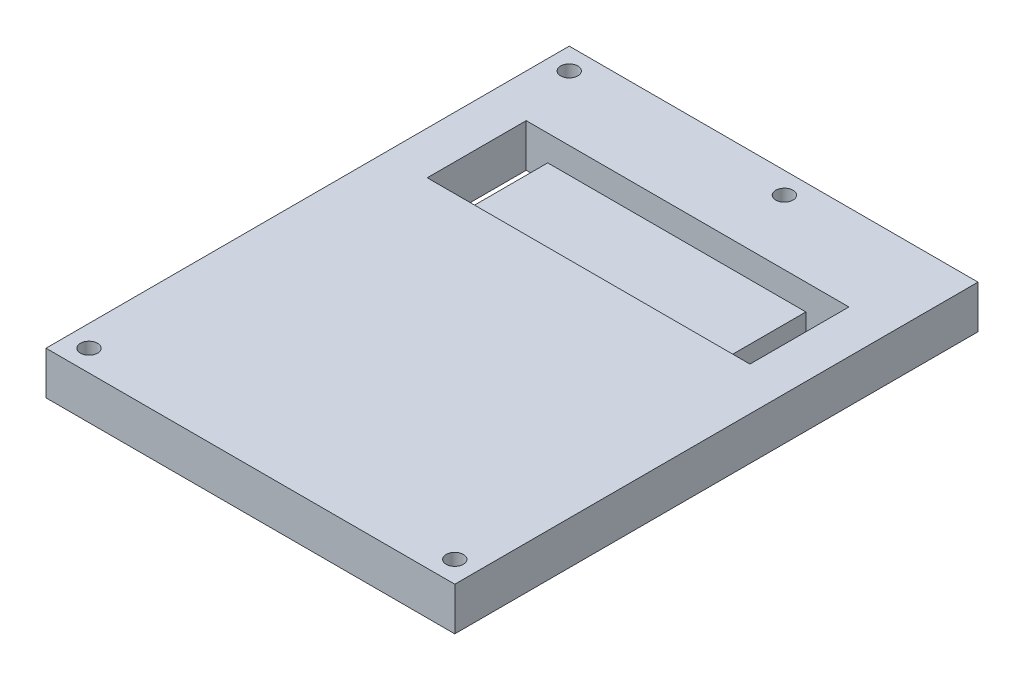
from build123d import *

# Parameters (mm, degrees)
SKETCH_1_W          = 47.5
SKETCH_1_H          = 60.8
EXTRUDE_1_DEPTH     = 5
SKETCH_2_W          = 37.5
SKETCH_2_H          = 11.5
CUT_EXTRUDE_1_DEPTH = 3
SKETCH_3_W          = 2.5
SKETCH_3_H          = 11.5
SKETCH_3_W_2        = 5
CUT_EXTRUDE_2_DEPTH = 2
SKETCH_4_R          = 1
CUT_EXTRUDE_3_DEPTH = 5


with BuildPart() as part:
    # 草图1 → 凸台-拉伸1 (new body)
    with BuildSketch(Plane(origin=(0, 0, 0), x_dir=(1, 0, 0), z_dir=(0, 1, 0))):
        with Locations((-30.655286344, 2.938237127)):
            Rectangle(SKETCH_1_W, SKETCH_1_H)
    extrude(amount=-EXTRUDE_1_DEPTH)

    # 草图2 → 切除-拉伸1 (cut)
    with BuildSketch(Plane(origin=(0, 0, 0), x_dir=(1, 0, 0), z_dir=(0, 1, 0))):
        with Locations((-30.655286344, 17.588237127)):
            Rectangle(SKETCH_2_W, SKETCH_2_H)
    extrude(amount=-CUT_EXTRUDE_1_DEPTH, mode=Mode.SUBTRACT)

    # 草图3 → 切除-拉伸2 (cut)
    with BuildSketch(Plane(origin=(0, -3, 0), x_dir=(1, 0, 0), z_dir=(0, 1, 0))):
        with Locations((-48.155286344, 17.588237127)):
            Rectangle(SKETCH_3_W, SKETCH_3_H)
        with Locations((-14.405286344, 17.588237127)):
            Rectangle(SKETCH_3_W_2, SKETCH_3_H)
    extrude(amount=-CUT_EXTRUDE_2_DEPTH, mode=Mode.SUBTRACT)

    # 草图4 → 切除-拉伸3 (cut)
    with BuildSketch(Plane(origin=(0, 0, 0), x_dir=(1, 0, 0), z_dir=(0, 1, 0))):
        with Locations(Location((-9.405286344, -24.961762873, 0), (0, 0, 270))):
            Circle(SKETCH_4_R)
        with Locations(Location((-51.905286344, -24.961762873, 0), (0, 0, 270))):
            Circle(SKETCH_4_R)
        with Locations(Location((-51.905286344, 30.838237127, 0), (0, 0, 270))):
            Circle(SKETCH_4_R)
        with Locations(Location((-26.905286344, 30.838237127, 0), (0, 0, 270))):
            Circle(SKETCH_4_R)
    extrude(amount=-CUT_EXTRUDE_3_DEPTH, mode=Mode.SUBTRACT)


solid = part.part
